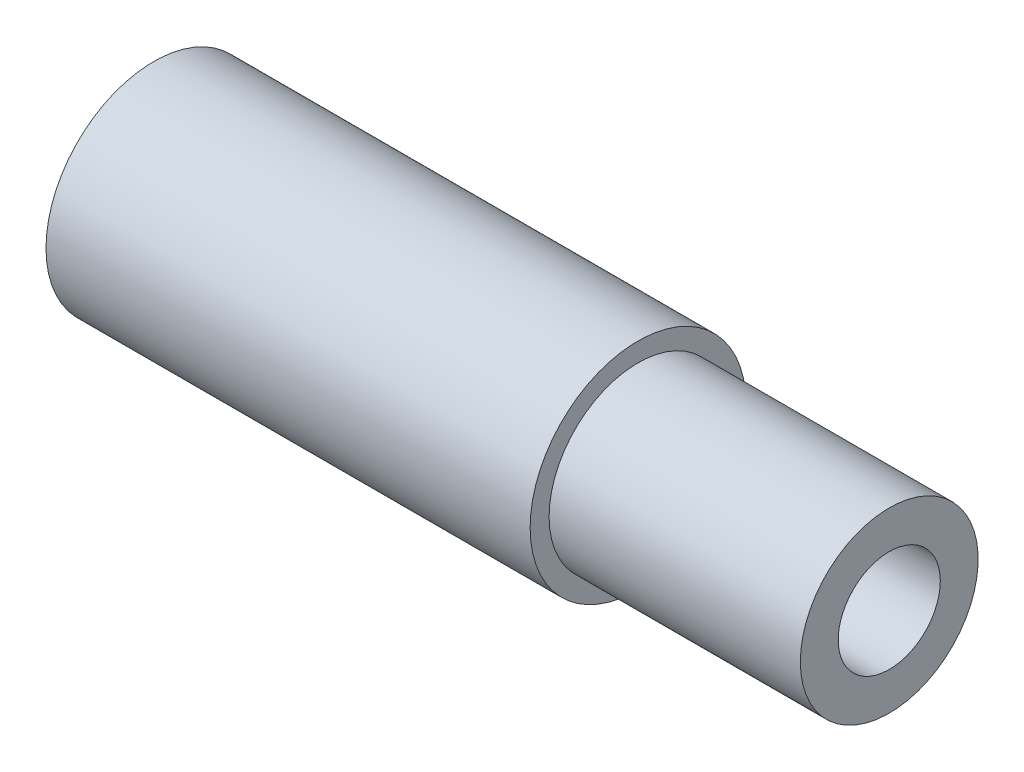
from build123d import *

# Parameters (mm, degrees)
F_4_40_TAPPED_HOLE2_D     = 2.2606
F_4_40_TAPPED_HOLE2_DEPTH = 5.08
F_4_40_TAPPED_HOLE2_TIP   = 0.679152758


with BuildPart() as part:
    # Sketch1 → Revolve1 (revolve)
    with BuildSketch(Plane.XY, mode=Mode.PRIVATE) as revolve1_sk:
        Polygon((0, 0), (0, -2.3876), (10.7188, -2.3876), (10.7188, -1.9685), (16.2814, -1.9685), (16.2814, 0), align=None)
    revolve(revolve1_sk.sketch.rotate(Axis((0, 0, 0), (1, 0, 0)), 270), axis=Axis((0, 0, 0), (1, 0, 0)))

    # #4-40 Tapped Hole2
    with Locations(Plane(origin=(16.2814, 0, 0), x_dir=(0, 0, -1), z_dir=(1, 0, 0))):
        with Locations((0, 0)):
            Hole(F_4_40_TAPPED_HOLE2_D / 2, depth=F_4_40_TAPPED_HOLE2_DEPTH)
            with Locations((0, 0, -(F_4_40_TAPPED_HOLE2_DEPTH + F_4_40_TAPPED_HOLE2_TIP / 2))):  # 118° drill point
                Cone(0, F_4_40_TAPPED_HOLE2_D / 2, F_4_40_TAPPED_HOLE2_TIP, mode=Mode.SUBTRACT)


solid = part.part
